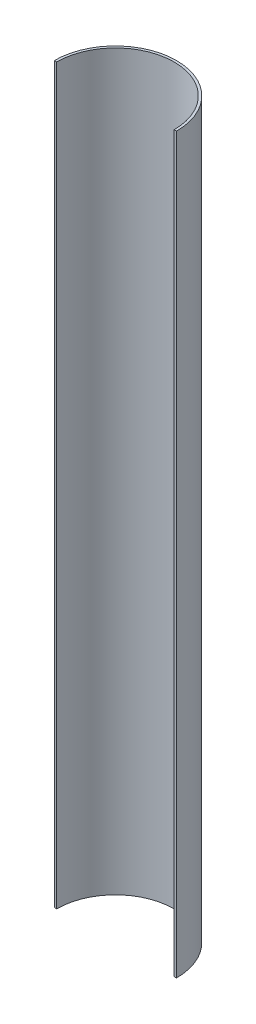
from build123d import *

# Parameters (mm, degrees)
BOSS_EXTRUDE1_DEPTH = 1500


with BuildPart() as part:
    # Sketch2 → Boss-Extrude1 (new body)
    with BuildSketch(Plane(origin=(0, 0, 0), x_dir=(1, 0, 0), z_dir=(0, 1, 0))):
        with BuildLine():
            ThreePointArc((-120, 0), (0, 120), (120, 0))
            Line((120, 0), (125, 0))
            ThreePointArc((125, 0), (0, 125), (-125, 0))
            Line((-125, 0), (-120, 0))
        make_face()
    extrude(amount=BOSS_EXTRUDE1_DEPTH)


solid = part.part
